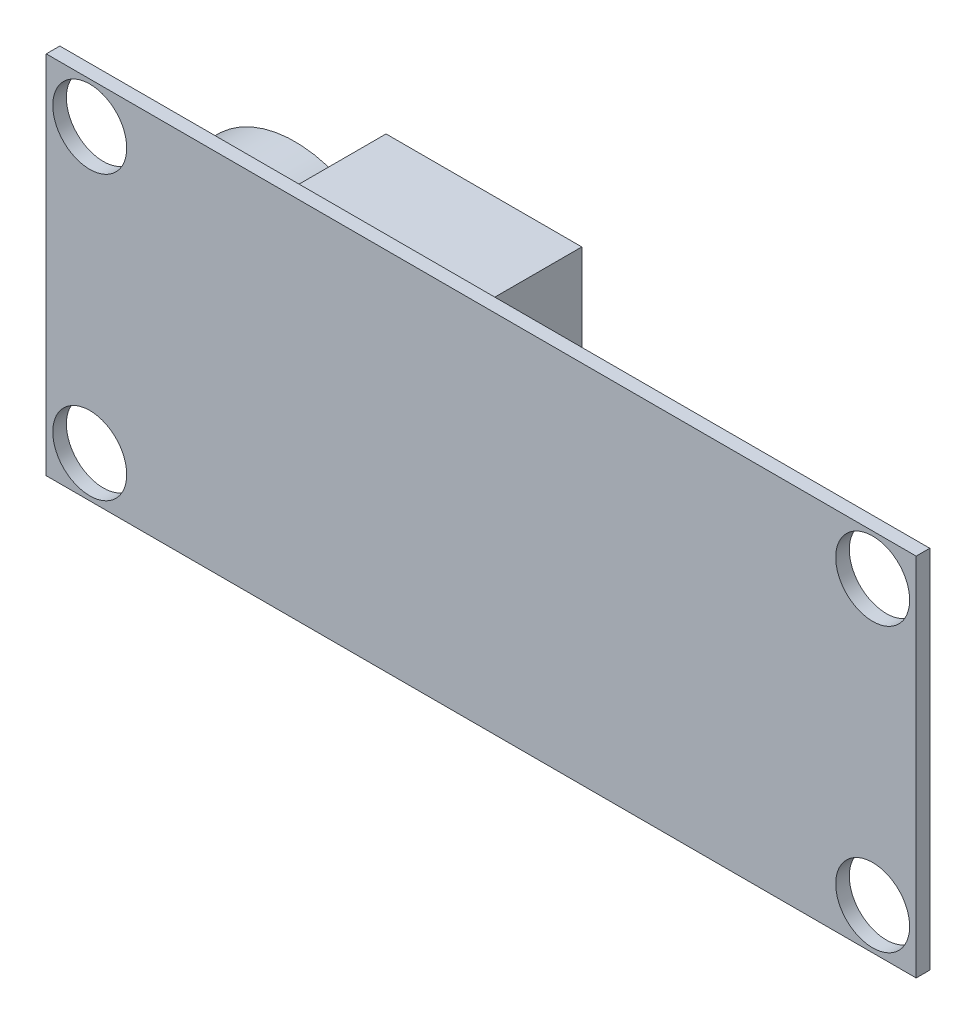
from build123d import *

# Parameters (mm, degrees)
SKETCH1_W           = 50.8
SKETCH1_H           = 21.336
BOSS_EXTRUDE1_DEPTH = 0.79375
SKETCH2_R           = 2.159
CUT_EXTRUDE1_DEPTH  = 56.104400324
SKETCH3_R           = 6.35
SKETCH3_W           = 11.43
SKETCH3_H           = 5.08
BOSS_EXTRUDE2_DEPTH = 6.35
SKETCH4_R           = 3.048
BOSS_EXTRUDE3_DEPTH = 10.16


with BuildPart() as part:
    # Sketch1 → Boss-Extrude1 (new body)
    with BuildSketch(Plane.XY):
        with Locations((25.4, 10.668)):
            Rectangle(SKETCH1_W, SKETCH1_H)
    extrude(amount=BOSS_EXTRUDE1_DEPTH)

    # Sketch2 → Cut-Extrude1 (cut, through all)
    with BuildSketch(Plane.XY.offset(0.79375)):
        with Locations((2.54, 18.923)):
            Circle(SKETCH2_R)
        with Locations((2.54, 2.413)):
            Circle(SKETCH2_R)
        with Locations((48.26, 2.413)):
            Circle(SKETCH2_R)
        with Locations((48.26, 18.923)):
            Circle(SKETCH2_R)
    extrude(amount=-CUT_EXTRUDE1_DEPTH, mode=Mode.SUBTRACT)

    # Sketch3 → Boss-Extrude2 (add)
    with BuildSketch(Plane(origin=(0, 0, 0), x_dir=(-1, 0, 0), z_dir=(0, 0, -1))):
        with Locations((-7.377120002, 10.668)):
            Circle(SKETCH3_R)
        with Locations((-18.415, 17.526)):
            Rectangle(SKETCH3_W, SKETCH3_H)
        with Locations((-18.415, 3.81)):
            Rectangle(SKETCH3_W, SKETCH3_H)
    extrude(amount=BOSS_EXTRUDE2_DEPTH)


with BuildPart() as body_2:
    # Sketch4 → Boss-Extrude3 (new body)
    with BuildSketch(Plane(origin=(24.13, 0, 0), x_dir=(0, 0, -1), z_dir=(1, 0, 0))):
        with Locations((3.227106746, 10.668)):
            Circle(SKETCH4_R)
    extrude(amount=-BOSS_EXTRUDE3_DEPTH)


solid = Compound([part.part, body_2.part])
